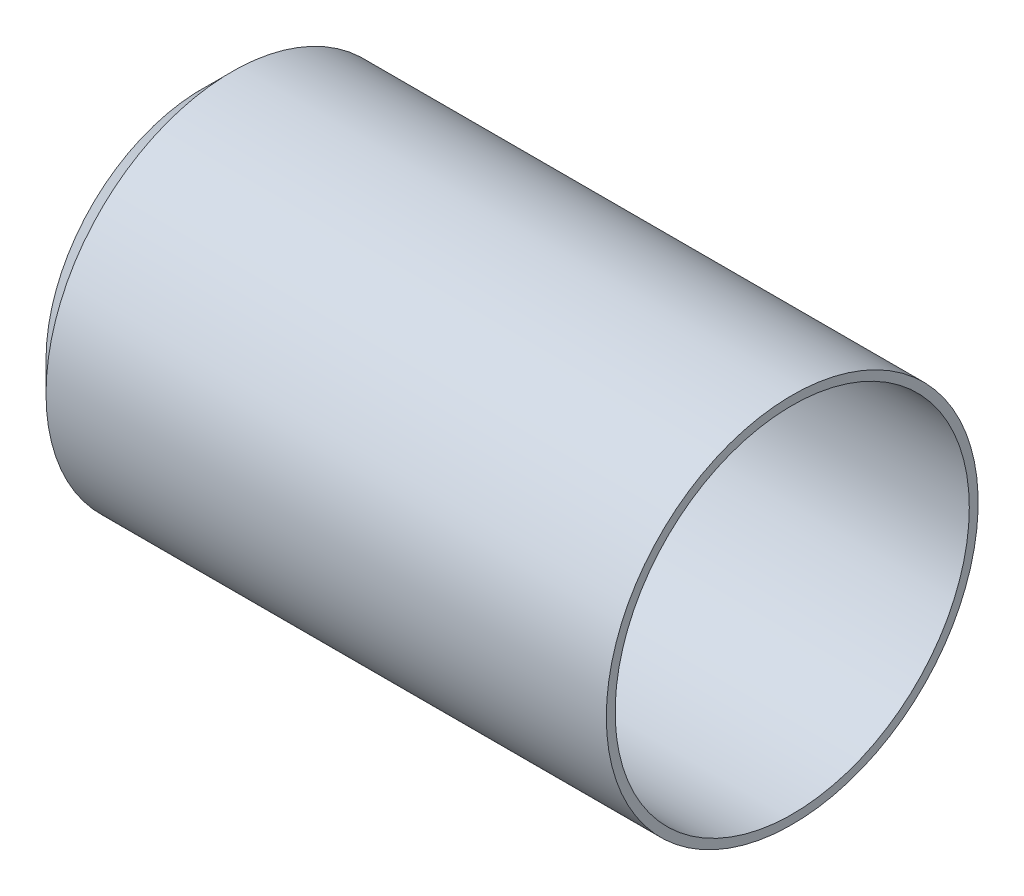
from build123d import *

# Parameters (mm, degrees)
SKETCH1_R           = 31.525
BOSS_EXTRUDE1_DEPTH = 100
SKETCH3_R           = 30.025
CUT_EXTRUDE1_DEPTH  = 95
CHAMFER2_SIZE       = 5


with BuildPart() as part:
    # Sketch1 → Boss-Extrude1 (new body)
    with BuildSketch(Plane(origin=(0, 0, 0), x_dir=(0, 0, -1), z_dir=(1, 0, 0))):
        with Locations(Location((0, 0, 0), (0, 0, 180))):
            Circle(SKETCH1_R)
    extrude(amount=BOSS_EXTRUDE1_DEPTH)

    # Sketch3 → Cut-Extrude1 (cut)
    with BuildSketch(Plane(origin=(100, 0, 0), x_dir=(0, 0, -1), z_dir=(1, 0, 0))):
        Circle(SKETCH3_R)
    extrude(amount=-CUT_EXTRUDE1_DEPTH, mode=Mode.SUBTRACT)

    # Chamfer2
    chamfer2_edges = [part.edges().sort_by_distance(p)[0] for p in [
        (0, 0, -31.525),
    ]]
    chamfer(chamfer2_edges, length=CHAMFER2_SIZE)


solid = part.part
